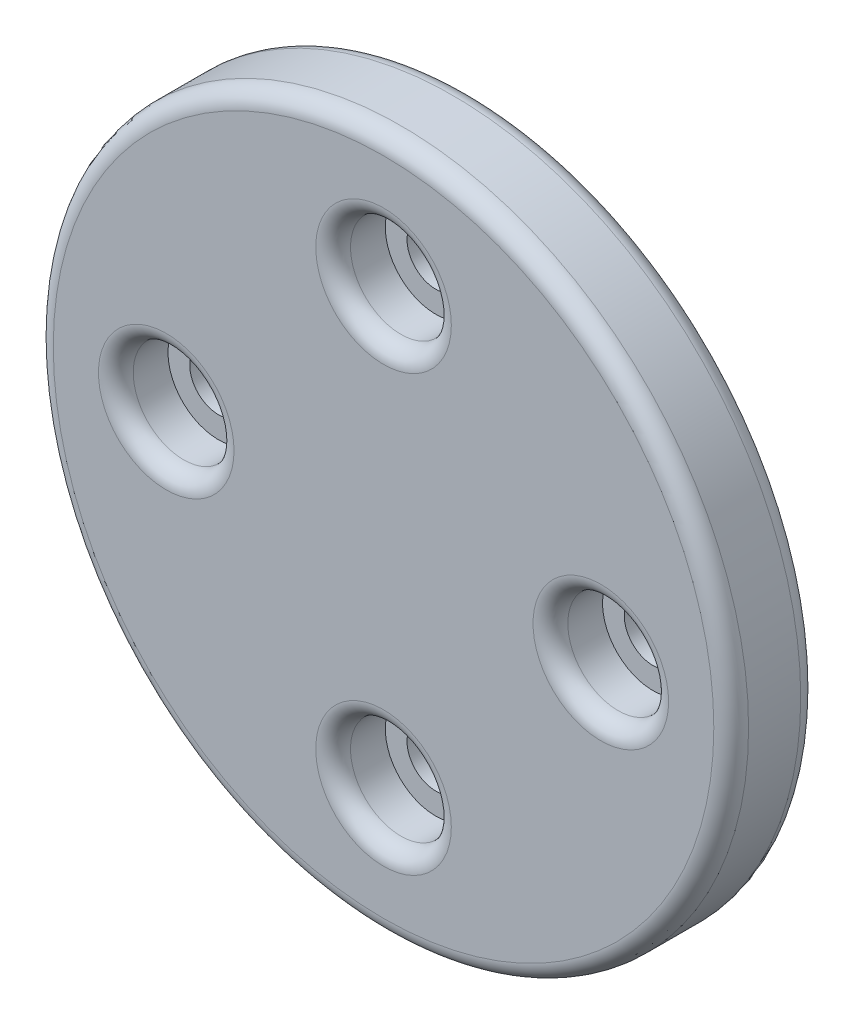
from build123d import *

# Parameters (mm, degrees)
SKIZZE1_R                       = 20
SKIZZE1_R_2                     = 1.65
AUFSATZ_LINEAR_AUSTRAGEN1_DEPTH = 5
SKIZZE2_R                       = 2.9
SCHNITT_LINEAR_AUSTRAGEN1_DEPTH = 3
VERRUNDUNG1_R                   = 1


with BuildPart() as part:
    # Skizze1 → Aufsatz-Linear austragen1 (new body)
    with BuildSketch(Plane.XY):
        Circle(SKIZZE1_R)
        with Locations((12.5, 0)):
            Circle(SKIZZE1_R_2, mode=Mode.SUBTRACT)
        with Locations((0, -12.5)):
            Circle(SKIZZE1_R_2, mode=Mode.SUBTRACT)
        with Locations((-12.5, 0)):
            Circle(SKIZZE1_R_2, mode=Mode.SUBTRACT)
        with Locations((0, 12.5)):
            Circle(SKIZZE1_R_2, mode=Mode.SUBTRACT)
    extrude(amount=AUFSATZ_LINEAR_AUSTRAGEN1_DEPTH)

    # Skizze2 → Schnitt-Linear austragen1 (cut)
    with BuildSketch(Plane.XY.offset(5)):
        with Locations((0, 12.5)):
            Circle(SKIZZE2_R)
        with Locations((12.5, 0)):
            Circle(SKIZZE2_R)
        with Locations((0, -12.5)):
            Circle(SKIZZE2_R)
        with Locations((-12.5, 0)):
            Circle(SKIZZE2_R)
    extrude(amount=-SCHNITT_LINEAR_AUSTRAGEN1_DEPTH, mode=Mode.SUBTRACT)

    # Verrundung1
    verrundung1_edges = [part.edges().sort_by_distance(p)[0] for p in [
        (-2.9, 12.5, 5),
        (9.6, 0, 5),
        (-20, 0, 5),
        (-2.9, -12.5, 5),
        (-15.4, 0, 5),
        (-20, 0, 0),
        (10.85, 0, 0),
        (-1.65, -12.5, 0),
        (-14.15, 0, 0),
        (-1.65, 12.5, 0),
    ]]
    fillet(verrundung1_edges, radius=VERRUNDUNG1_R)


solid = part.part
